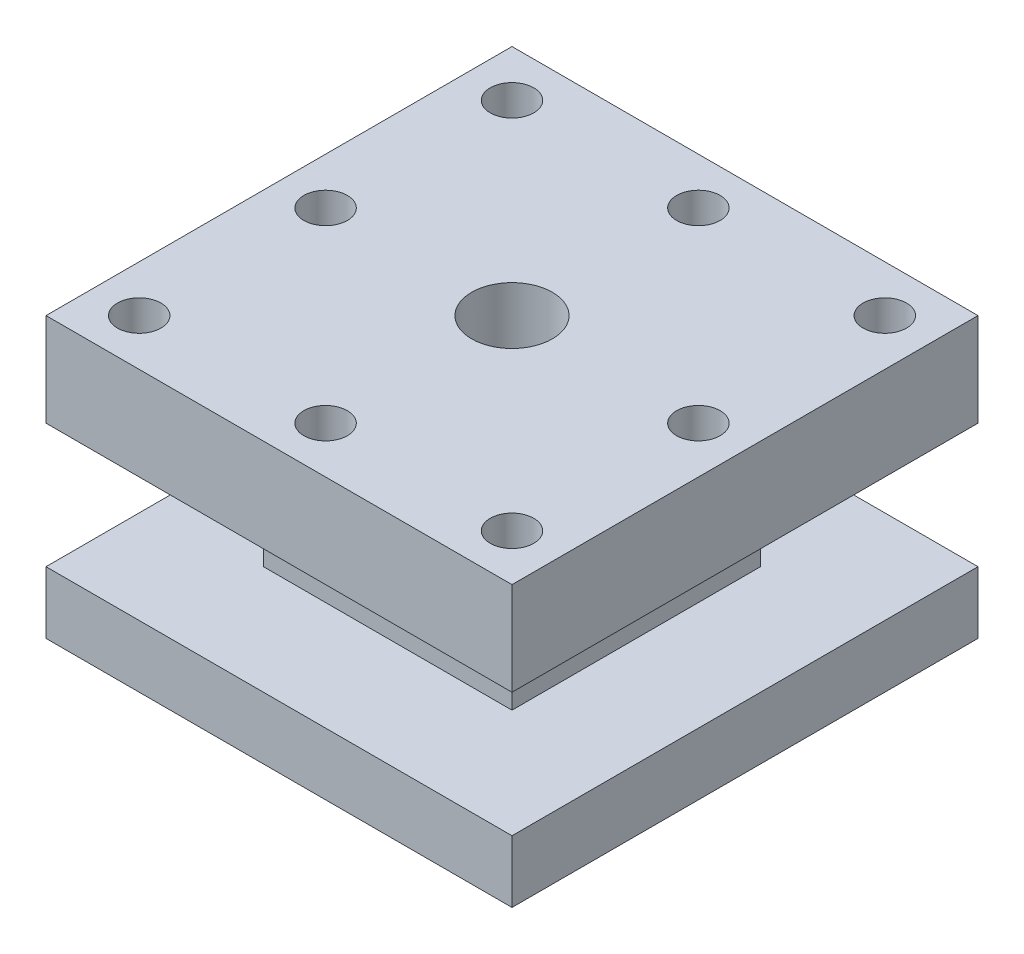
from build123d import *

# Parameters (mm, degrees)
SKETCH2_W                      = 150
SKETCH2_H                      = 150
BOSS_EXTRUDE1_DEPTH            = 30
SKETCH3_W                      = 80
SKETCH3_H                      = 80
BOSS_EXTRUDE2_DEPTH            = 40
SKETCH4_W                      = 150
SKETCH4_H                      = 150
BOSS_EXTRUDE3_DEPTH            = 20
HOLE1_D                        = 26
HOLE1_DEPTH                    = 100
HOLE1_CBORE_D                  = 60
HOLE1_CBORE_DEPTH              = 10
M16_TAPPED_HOLE2_D             = 14
M16_TAPPED_HOLE2_DEPTH         = 30
F_10_0_10_DIAMETER_HOLE1_D     = 10
F_10_0_10_DIAMETER_HOLE1_DEPTH = 16
F_10_0_10_DIAMETER_HOLE1_TIP   = 3.004303095
CHAMFER1_SIZE                  = 2


with BuildPart() as part:
    # Sketch2 → Boss-Extrude1 (new body)
    with BuildSketch(Plane(origin=(0, 0, 0), x_dir=(1, 0, 0), z_dir=(0, 1, 0))):
        Rectangle(SKETCH2_W, SKETCH2_H)
    extrude(amount=-BOSS_EXTRUDE1_DEPTH)

    # Sketch3 → Boss-Extrude2 (add)
    with BuildSketch(Plane.XZ.offset(30)):
        Rectangle(SKETCH3_W, SKETCH3_H)
    extrude(amount=BOSS_EXTRUDE2_DEPTH)

    # Sketch4 → Boss-Extrude3 (add)
    with BuildSketch(Plane.XZ.offset(70)):
        Rectangle(SKETCH4_W, SKETCH4_H)
    extrude(amount=BOSS_EXTRUDE3_DEPTH)

    # Hole1
    with Locations(Plane(origin=(0, -90, 0), x_dir=(-1, 0, 0), z_dir=(0, -1, 0))):
        with Locations((0, 0)):
            CounterBoreHole(HOLE1_D / 2, HOLE1_CBORE_D / 2, HOLE1_CBORE_DEPTH, depth=HOLE1_DEPTH)

    # M16 Tapped Hole2
    with Locations(Plane(origin=(0, 0, 0), x_dir=(1, 0, 0), z_dir=(0, 1, 0))):
        with Locations((60, -60), (-60, 60), (-60, -60), (60, 60), (0, 60), (-60, 0), (0, -60), (60, 0)):
            Hole(M16_TAPPED_HOLE2_D / 2, depth=M16_TAPPED_HOLE2_DEPTH)

    # Ø10.0 (10) Diameter Hole1
    with Locations(Plane(origin=(0, -90, 0), x_dir=(-1, 0, 0), z_dir=(0, -1, 0))):
        with Locations((-52, 0), (0, -52), (52, 0), (0, 52)):
            Hole(F_10_0_10_DIAMETER_HOLE1_D / 2, depth=F_10_0_10_DIAMETER_HOLE1_DEPTH)
            with Locations((0, 0, -(F_10_0_10_DIAMETER_HOLE1_DEPTH + F_10_0_10_DIAMETER_HOLE1_TIP / 2))):  # 118° drill point
                Cone(0, F_10_0_10_DIAMETER_HOLE1_D / 2, F_10_0_10_DIAMETER_HOLE1_TIP, mode=Mode.SUBTRACT)

    # Chamfer1
    chamfer1_edges = [part.edges().sort_by_distance(p)[0] for p in [
        (30, -90, 0),
    ]]
    chamfer(chamfer1_edges, length=CHAMFER1_SIZE)


solid = part.part
